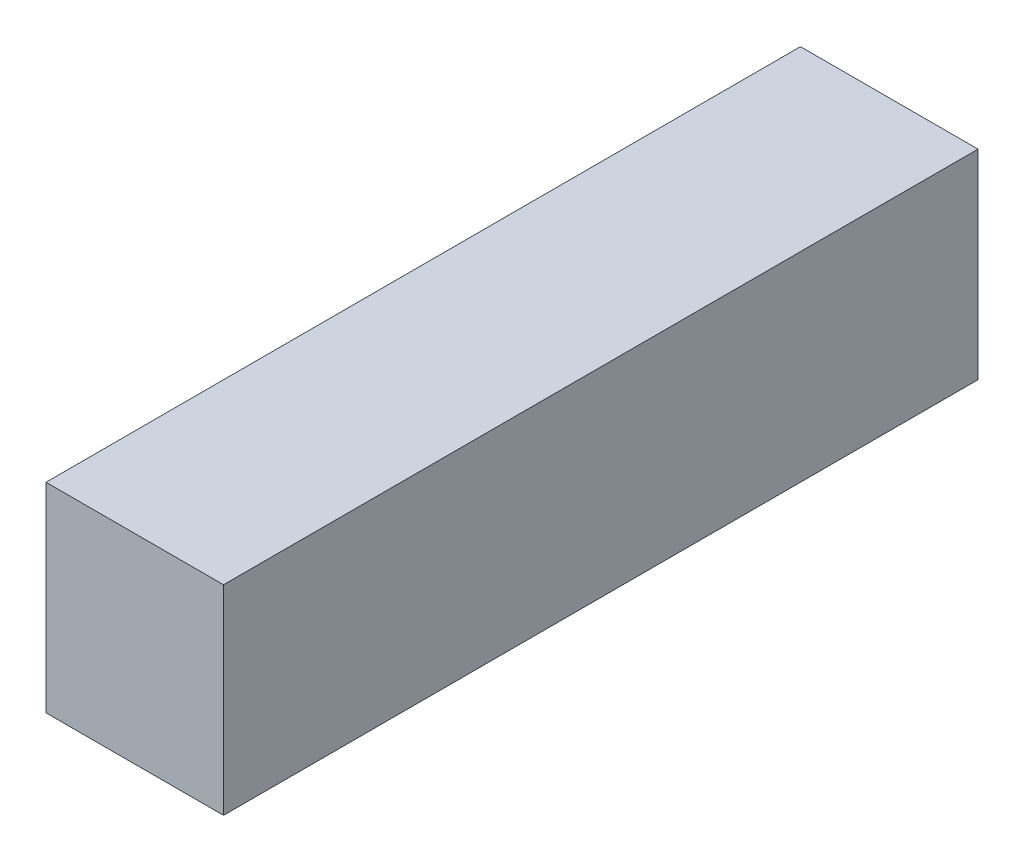
from build123d import *

# Parameters (mm, degrees)
SK_P01_XT60MATED_W  = 8
SK_P01_XT60MATED_H  = 34
P01_XT60MATED_DEPTH = 9


with BuildPart() as part:
    # SK_P01_XT60mated → P01_XT60mated (new body)
    with BuildSketch(Plane(origin=(0, 0, 0), x_dir=(1, 0, 0), z_dir=(0, 1, 0))):
        Rectangle(SK_P01_XT60MATED_W, SK_P01_XT60MATED_H)
    extrude(amount=P01_XT60MATED_DEPTH)


solid = part.part
